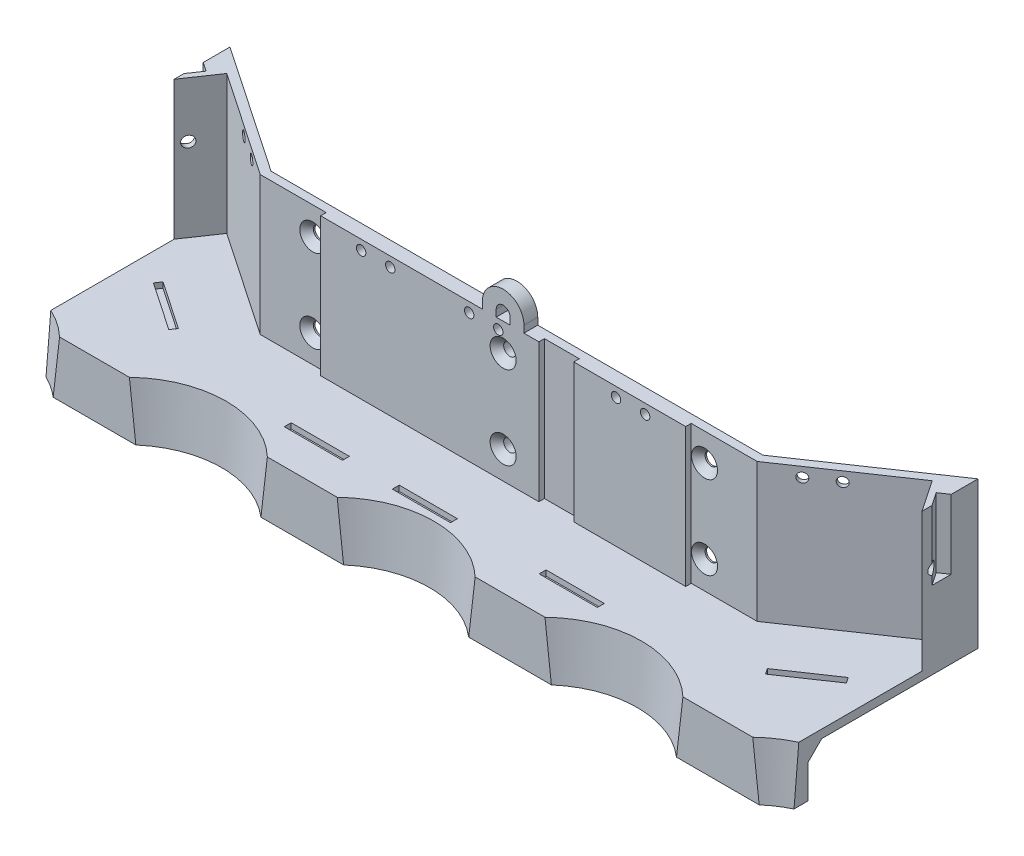
from build123d import *

# Parameters (mm, degrees)
BOSS_EXTRUDE1_DEPTH                                  = 135
BOSS_EXTRUDE2_REACH                                  = 151.416
BOSS_EXTRUDE2_DIRECTION_2_REACH                      = 151.416
CUT_EXTRUDE1_DEPTH                                   = 50
BOSS_EXTRUDE3_DEPTH                                  = 50
SKETCH9_R                                            = 2
CUT_EXTRUDE2_DEPTH                                   = 262.164206304
CUT_EXTRUDE3_START                                   = -2
SKETCH10_W                                           = 8.681737756
SKETCH10_H                                           = 10
CUT_EXTRUDE3_DEPTH                                   = 260.164206304
SKETCH11_W                                           = 78.8
SKETCH11_H                                           = 50
SKETCH11_W_2                                         = 40.4
BOSS_EXTRUDE4_DEPTH                                  = 2
SKETCH15_W                                           = 21
SKETCH15_H                                           = 2.5
CUT_EXTRUDE8_DEPTH                                   = 2
SKETCH16_R                                           = 1.5
CUT_EXTRUDE9_DEPTH                                   = 150.530879357
SKETCH17_R                                           = 1.5
CUT_EXTRUDE10_DEPTH                                  = 189.655270521
CSK_FOR_M4_COUNTERSUNK_RAISED_HEAD_SCREW_D           = 4.5
CSK_FOR_M4_COUNTERSUNK_RAISED_HEAD_SCREW_CSINK_D     = 9.4
CSK_FOR_M4_COUNTERSUNK_RAISED_HEAD_SCREW_CSINK_ANGLE = 90
BOSS_EXTRUDE5_DEPTH                                  = 5
CUT_EXTRUDE11_DEPTH                                  = 148.817454991
CSK_FOR_M4_COUNTERSUNK_RAISED_HEAD_S_2_D             = 4.5
CSK_FOR_M4_COUNTERSUNK_RAISED_HEAD_S_2_CSINK_D       = 9.4
CSK_FOR_M4_COUNTERSUNK_RAISED_HEAD_S_2_CSINK_ANGLE   = 90
CSK_FOR_M3_COUNTERSUNK_RAISED_HEAD_SCREW_D           = 3.4
CSK_FOR_M3_COUNTERSUNK_RAISED_HEAD_SCREW_CSINK_D     = 6.3
CSK_FOR_M3_COUNTERSUNK_RAISED_HEAD_SCREW_CSINK_ANGLE = 90
CSK_FOR_M3_COUNTERSUNK_RAISED_HEAD_S_2_D             = 3.4
CSK_FOR_M3_COUNTERSUNK_RAISED_HEAD_S_2_CSINK_D       = 6.3
CSK_FOR_M3_COUNTERSUNK_RAISED_HEAD_S_2_CSINK_ANGLE   = 90


with BuildPart() as part:
    # Sketch1 → Boss-Extrude1 (new, symmetric)
    with BuildSketch(Plane(origin=(0, 0, 0), x_dir=(0, 0, -1), z_dir=(1, 0, 0))):
        Polygon((0, 0), (0, 53), (-3, 53), (-3, 3), (-40, 3), (-40, 0), (-40, -17), (-30, -17), (-30, -5), (-25, 0), align=None)
    extrude(amount=BOSS_EXTRUDE1_DEPTH, both=True)

    # Sketch2 → Cut-Revolve1 (revolve, cut)
    with BuildSketch(Plane(origin=(0, 0, 0), x_dir=(0, 0, -1), z_dir=(1, 0, 0))):
        Polygon((-66, 3), (-30, 3), (-39, -112), (-66, -112), align=None)
    revolve(axis=Axis((0, 3, 66), (0, -1, 0)), mode=Mode.SUBTRACT)

    # Sketch3 → Cut-Revolve2 (revolve, cut)
    with BuildSketch(Plane(origin=(75, 0, 0), x_dir=(0, 0, -1), z_dir=(1, 0, 0))):
        Polygon((-30, 3), (-66, 3), (-66, -112), (-39, -112), align=None)
    cut_revolve2 = revolve(axis=Axis((75, 3, 66), (0, -1, 0)), mode=Mode.SUBTRACT)

    # Sketch4 → Cut-Revolve3 (revolve, cut)
    with BuildSketch(Plane(origin=(150, 0, 0), x_dir=(0, 0, -1), z_dir=(1, 0, 0))):
        Polygon((-30, 3), (-66, 3), (-66, -112), (-39, -112), align=None)
    cut_revolve3 = revolve(axis=Axis((150, 3, 66), (0, -1, 0)), mode=Mode.SUBTRACT)

    # Boss-Extrude2: up to this face of the body (flat: up to its plane)
    boss_extrude2_end = Plane(part.part.faces().sort_by_distance((0, 53, 1.5))[0])
    # Sketch5 → Boss-Extrude2 (add, up to the picked face)
    with BuildSketch(Plane(origin=(0, 3, 0), x_dir=(1, 0, 0), z_dir=(0, 1, 0)), mode=Mode.PRIVATE) as boss_extrude2_sk1:
        Polygon((89.696341704, -3), (135, -3), (135, 27.780279129), (135, 31.407195461), (84.358099725, -3), align=None)
    boss_extrude2_tool1 = split(extrude(boss_extrude2_sk1.sketch, amount=BOSS_EXTRUDE2_REACH, mode=Mode.PRIVATE), bisect_by=boss_extrude2_end, keep=Keep.BOTH, mode=Mode.PRIVATE)
    boss_extrude2 = boss_extrude2_tool1.solids().sort_by(Axis((118.119367, 3, -8.469065), (0, 1, 0)))[0]
    add(boss_extrude2)

    # Boss-Extrude2 direction 2: up to this face of the body (flat: up to its plane)
    boss_extrude2_direction_2_end = Plane(part.part.faces().sort_by_distance((0, 0, 12.5))[0])
    # Sketch5 → Boss-Extrude2 direction 2 (add, up to the picked face)
    with BuildSketch(Plane(origin=(0, 3, 0), x_dir=(1, 0, 0), z_dir=(0, 1, 0)), mode=Mode.PRIVATE) as boss_extrude2_direction_2_sk1:
        Polygon((89.696341704, -3), (135, -3), (135, 27.780279129), (135, 31.407195461), (84.358099725, -3), align=None)
    boss_extrude2_direction_2_tool1 = split(extrude(boss_extrude2_direction_2_sk1.sketch, amount=-BOSS_EXTRUDE2_DIRECTION_2_REACH, mode=Mode.PRIVATE), bisect_by=boss_extrude2_direction_2_end, keep=Keep.BOTH, mode=Mode.PRIVATE)
    boss_extrude2_direction_2 = boss_extrude2_direction_2_tool1.solids().sort_by(Axis((118.119367, 3, -8.469065), (0, -1, 0)))[0]
    add(boss_extrude2_direction_2)

    # Sketch7 → Cut-Extrude1 (cut)
    with BuildSketch(Plane(origin=(0, 3, 0), x_dir=(1, 0, 0), z_dir=(0, 1, 0))):
        Polygon((89.696341704, -3), (135, 27.780279129), (135, -3), align=None)
    cut_extrude1 = extrude(amount=CUT_EXTRUDE1_DEPTH, mode=Mode.SUBTRACT)

    # Sketch8 → Boss-Extrude3 (add)
    with BuildSketch(Plane(origin=(0, 3, 0), x_dir=(1, 0, 0), z_dir=(0, 1, 0))):
        Polygon((135, 27.780279129), (127.311099154, 22.556274642), (135, 11.239439757), align=None)
    boss_extrude3 = extrude(amount=BOSS_EXTRUDE3_DEPTH)

    # Sketch9 → Cut-Extrude2 (cut, through all)
    with BuildSketch(Plane(origin=(97.588254801, 0, -66.303557715), x_dir=(0.5619827673392628, 0, 0.8271489401635621), z_dir=(-0.8271489401635621, 0, 0.5619827673392628))):
        with Locations((62.889245152, 33)):
            Circle(SKETCH9_R)
    cut_extrude2 = extrude(amount=-CUT_EXTRUDE2_DEPTH, mode=Mode.SUBTRACT)

    # Sketch10 → Cut-Extrude3 (cut, through all)
    with BuildSketch(Plane(origin=(97.588254801, 0, -66.303557715), x_dir=(0.5619827673392628, 0, 0.8271489401635621), z_dir=(-0.8271489401635621, 0, 0.5619827673392628)).offset(CUT_EXTRUDE3_START)):
        with Locations((62.23011403, 33)):
            Rectangle(SKETCH10_W, SKETCH10_H)
    cut_extrude3 = extrude(amount=-CUT_EXTRUDE3_DEPTH, mode=Mode.SUBTRACT)

    # Mirror1: Cut-Revolve2, Cut-Revolve3, Boss-Extrude2, Boss-Extrude2 direction 2, Cut-Extrude1, Boss-Extrude3, Cut-Extrude2, Cut-Extrude3 across plane
    add(cut_revolve2.mirror(Plane(origin=(0, 0, 0), x_dir=(0, 0, 1), z_dir=(1, 0, 0))), mode=Mode.SUBTRACT)
    add(cut_revolve3.mirror(Plane(origin=(0, 0, 0), x_dir=(0, 0, 1), z_dir=(1, 0, 0))), mode=Mode.SUBTRACT)
    add(boss_extrude2.mirror(Plane(origin=(0, 0, 0), x_dir=(0, 0, 1), z_dir=(1, 0, 0))))
    add(boss_extrude2_direction_2.mirror(Plane(origin=(0, 0, 0), x_dir=(0, 0, 1), z_dir=(1, 0, 0))))
    add(cut_extrude1.mirror(Plane(origin=(0, 0, 0), x_dir=(0, 0, 1), z_dir=(1, 0, 0))), mode=Mode.SUBTRACT)
    add(boss_extrude3.mirror(Plane(origin=(0, 0, 0), x_dir=(0, 0, 1), z_dir=(1, 0, 0))))
    add(cut_extrude2.mirror(Plane(origin=(0, 0, 0), x_dir=(0, 0, 1), z_dir=(1, 0, 0))), mode=Mode.SUBTRACT)
    add(cut_extrude3.mirror(Plane(origin=(0, 0, 0), x_dir=(0, 0, 1), z_dir=(1, 0, 0))), mode=Mode.SUBTRACT)

    # Sketch11 → Boss-Extrude4 (add)
    with BuildSketch(Plane.XY.offset(3)):
        with Locations((-26.5, 28)):
            Rectangle(SKETCH11_W, SKETCH11_H)
        with Locations((45.7, 28)):
            Rectangle(SKETCH11_W_2, SKETCH11_H)
    extrude(amount=BOSS_EXTRUDE4_DEPTH)

    # Sketch15 → Cut-Extrude8 (cut)
    with BuildSketch(Plane(origin=(0, 3, 0), x_dir=(1, 0, 0), z_dir=(0, 1, 0))):
        Polygon((-107.696902753, -17.971904438), (-125.067030496, -6.170266324), (-123.662073578, -4.102393974), (-106.291945834, -15.904032088), align=None)
        with Locations((-46, -26.25)):
            Rectangle(SKETCH15_W, SKETCH15_H)
        with Locations((-7, -26.25)):
            Rectangle(SKETCH15_W, SKETCH15_H)
        with Locations((46, -26.25)):
            Rectangle(SKETCH15_W, SKETCH15_H)
        Polygon((106.291945834, -15.904032088), (123.662073578, -4.102393974), (125.067030496, -6.170266324), (107.696902753, -17.971904438), align=None)
    extrude(amount=-CUT_EXTRUDE8_DEPTH, mode=Mode.SUBTRACT)

    # Sketch16 → Cut-Extrude9 (cut, through all)
    with BuildSketch(Plane.XY.offset(5)):
        with Locations((-1.75, 49.5)):
            Circle(SKETCH16_R)
        with Locations((-12.25, 49.5)):
            Circle(SKETCH16_R)
        with Locations((-40.75, 49.5)):
            Circle(SKETCH16_R)
        with Locations((-51.25, 49.5)):
            Circle(SKETCH16_R)
        with Locations((51.25, 49.5)):
            Circle(SKETCH16_R)
        with Locations((40.75, 49.5)):
            Circle(SKETCH16_R)
    extrude(amount=-CUT_EXTRUDE9_DEPTH, mode=Mode.SUBTRACT)

    # Sketch17 → Cut-Extrude10 (cut, through all)
    with BuildSketch(Plane(origin=(-29.722844353, 0, 43.747283073), x_dir=(0.8271489401635628, 0, 0.5619827673392619), z_dir=(-0.5619827673392618, 0, 0.8271489401635627))):
        with Locations((-94.73147838, 49.5)):
            Circle(SKETCH17_R)
        with Locations((-84.23147838, 49.5)):
            Circle(SKETCH17_R)
    cut_extrude10 = extrude(amount=-CUT_EXTRUDE10_DEPTH, mode=Mode.SUBTRACT)

    # Mirror2: Cut-Extrude10 across plane
    add(cut_extrude10.mirror(Plane(origin=(0, 0, 0), x_dir=(0, 0, 1), z_dir=(1, 0, 0))), mode=Mode.SUBTRACT)

    # CSK for M4 Countersunk Raised Head Screw (through all)
    with Locations(Plane.XY.offset(3)):
        with Locations((-70.696341704, 43), (-70.696341704, 13), (70.696341704, 43), (70.696341704, 13)):
            CounterSinkHole(CSK_FOR_M4_COUNTERSUNK_RAISED_HEAD_SCREW_D / 2, CSK_FOR_M4_COUNTERSUNK_RAISED_HEAD_SCREW_CSINK_D / 2, counter_sink_angle=CSK_FOR_M4_COUNTERSUNK_RAISED_HEAD_SCREW_CSINK_ANGLE)

    # Sketch23 → Boss-Extrude5 (add)
    with BuildSketch(Plane.XY.offset(5)):
        with BuildLine():
            Line((-7.5, 53), (-7.5, 55.5))
            ThreePointArc((-7.5, 55.5), (0, 63), (7.5, 55.5))
            Line((7.5, 55.5), (7.5, 53))
            Line((7.5, 53), (2.5, 53))
            Line((2.5, 53), (2.5, 55.5))
            ThreePointArc((2.5, 55.5), (0, 58), (-2.5, 55.5))
            Line((-2.5, 55.5), (-2.5, 53))
            Line((-2.5, 53), (-7.5, 53))
        make_face()
    extrude(amount=-BOSS_EXTRUDE5_DEPTH)

    # Sketch24 → Cut-Extrude11 (cut, through all)
    with BuildSketch(Plane(origin=(0, 28, 0), x_dir=(1, 0, 0), z_dir=(0, 1, 0))):
        Polygon((135, 14.798267743), (135, 21.735418576), (131.775310871, 19.544495475), align=None)
        Polygon((-135, 21.735418576), (-135, 14.798267743), (-131.775310871, 19.544495475), align=None)
    extrude(amount=CUT_EXTRUDE11_DEPTH, mode=Mode.SUBTRACT)

    # CSK for M4 Countersunk Raised Head S 2 (through all)
    with Locations(Plane.XY.offset(5)):
        with Locations((0, 43), (0, 13)):
            CounterSinkHole(CSK_FOR_M4_COUNTERSUNK_RAISED_HEAD_S_2_D / 2, CSK_FOR_M4_COUNTERSUNK_RAISED_HEAD_S_2_CSINK_D / 2, counter_sink_angle=CSK_FOR_M4_COUNTERSUNK_RAISED_HEAD_S_2_CSINK_ANGLE)

    # CSK for M3 Countersunk Raised Head Screw (through all)
    with Locations(Plane(origin=(0, 0, 0), x_dir=(-1, 0, 0), z_dir=(0, 0, -1))):
        with Locations((-51.25, 49.5), (-40.75, 49.5), (1.75, 49.5), (12.25, 49.5), (40.75, 49.5), (51.25, 49.5)):
            CounterSinkHole(CSK_FOR_M3_COUNTERSUNK_RAISED_HEAD_SCREW_D / 2, CSK_FOR_M3_COUNTERSUNK_RAISED_HEAD_SCREW_CSINK_D / 2, counter_sink_angle=CSK_FOR_M3_COUNTERSUNK_RAISED_HEAD_SCREW_CSINK_ANGLE)

    # CSK for M3 Countersunk Raised Head S 2 (through all)
    with Locations(Plane(origin=(-28.036896051, 0, 41.265836253), x_dir=(-0.8271489401635628, 0, -0.5619827673392619), z_dir=(0.5619827673392618, 0, -0.8271489401635627))):
        with Locations((84.23147838, 49.5), (94.73147838, 49.5)):
            csk_for_m3_countersunk_raised_head_s_2 = CounterSinkHole(CSK_FOR_M3_COUNTERSUNK_RAISED_HEAD_S_2_D / 2, CSK_FOR_M3_COUNTERSUNK_RAISED_HEAD_S_2_CSINK_D / 2, counter_sink_angle=CSK_FOR_M3_COUNTERSUNK_RAISED_HEAD_S_2_CSINK_ANGLE)

    # Mirror3: CSK for M3 Countersunk Raised Head S 2 across plane
    add(csk_for_m3_countersunk_raised_head_s_2.mirror(Plane(origin=(0, 0, 0), x_dir=(0, 0, 1), z_dir=(1, 0, 0))), mode=Mode.SUBTRACT)


solid = part.part
